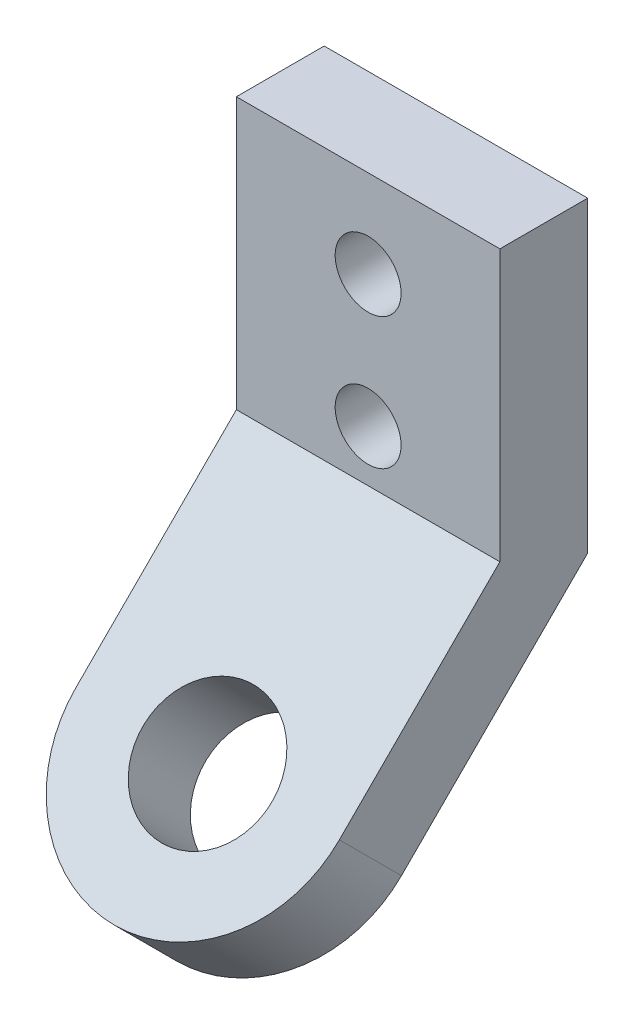
from build123d import *

# Parameters (mm, degrees)
BOSS_EXTRUDE1_DEPTH = 76.2
CUT_EXTRUDE1_DEPTH  = 267.359355894
SKETCH4_R           = 19.05
CUT_EXTRUDE2_DEPTH  = 243.798558814


with BuildPart() as part:
    # Sketch2 → Boss-Extrude1 (new body)
    with BuildSketch(Plane.YZ):
        Polygon((0, 0), (177.8, 0), (177.8, 50.8), (21.042048969, 50.8), (-125.69533605, 197.537385018), (-161.616360534, 161.616360534), align=None)
    extrude(amount=BOSS_EXTRUDE1_DEPTH)

    # Sketch3 → Cut-Extrude1 (cut, through all)
    with BuildSketch(Plane(origin=(0, 35.921024484, 35.921024484), x_dir=(-1, 0, 0), z_dir=(0, 0.7071067811865488, 0.7071067811865464))):
        with BuildLine():
            Line((-76.2, 228.560048969), (-76.2, 152.360048969))
            ThreePointArc((-76.2, 152.360048969), (-53.881536726, 206.241585695), (0, 228.560048969))
            Line((0, 228.560048969), (-76.2, 228.560048969))
        make_face()
        with BuildLine():
            Line((0, 114.895048969), (0, 189.825048969))
            ThreePointArc((0, 189.825048969), (-37.465, 152.360048969), (0, 114.895048969))
        make_face()
        with BuildLine():
            ThreePointArc((37.465, 152.360048969), (26.491755557, 178.851804526), (0, 189.825048969))
            Line((0, 189.825048969), (0, 114.895048969))
            ThreePointArc((0, 114.895048969), (26.491755557, 125.868293411), (37.465, 152.360048969))
        make_face()
    extrude(amount=-CUT_EXTRUDE1_DEPTH, mode=Mode.SUBTRACT)

    # Sketch4 → Cut-Extrude2 (cut, through all)
    with BuildSketch(Plane.XY.offset(50.8)):
        with Locations((0, 127)):
            Circle(SKETCH4_R)
        with Locations((0, 50.8)):
            Circle(SKETCH4_R)
    extrude(amount=-CUT_EXTRUDE2_DEPTH, mode=Mode.SUBTRACT)

    # Mirror1: part across plane


with BuildPart() as part_1:
    add(part.part)
    add(part.part.mirror(Plane(origin=(0, 0, 0), x_dir=(0, 0, 1), z_dir=(1, 0, 0))))


solid = part_1.part
